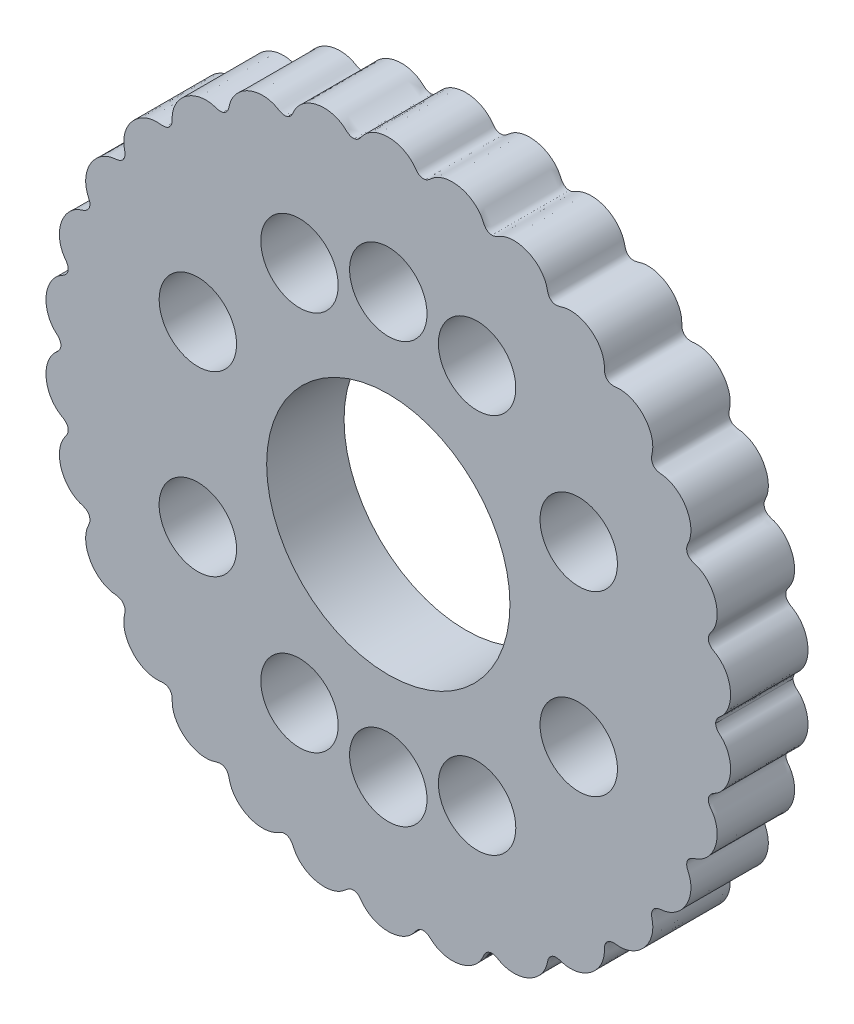
from build123d import *

# Parameters (mm, degrees)
BOSS_EXTRU_1_DEPTH      = 7
ESQUISSE2_R             = 3.5
ESQUISSE2_R_2           = 11
ENL_V_MAT_EXTRU_1_DEPTH = 45.429222529


with BuildPart() as part:
    # Esquisse1 → Boss.-Extru.1 (new body)
    with BuildSketch(Plane.XY):
        with BuildLine():
            add(Edge.make_bspline(
                [(29.6, 0), (29.6, -0.17346587), (29.759106864, -0.535683821), (30.110962154, -0.799020647), (30.373779595, -1.103467186), (30.671023666, -1.560938048), (30.906540811, -2.208142452), (30.979869374, -3.033375854), (30.845247931, -3.851352131), (30.565023341, -4.481835856), (30.246485608, -4.925727722), (29.960253365, -5.217593452), (29.640960083, -5.465239042), (29.250815494, -5.647425417), (28.885266009, -6.097323866), (28.977251739, -6.67834267), (29.271750181, -7.022312781), (29.468763653, -7.36916575), (29.619679918, -7.750390298), (29.740086607, -8.282593055), (29.751778171, -8.972575413), (29.555422294, -9.777910352), (29.16527121, -10.508677165), (28.695257551, -11.013160126), (28.244812231, -11.319043922), (27.880647842, -11.499834787), (27.471579825, -11.595893446), (27.006318633, -11.933415225), (26.943348567, -12.521679856), (27.160884744, -12.93167147), (27.28616792, -13.308128069), (27.382434324, -13.846858227), (27.347084399, -14.533511523), (27.091766805, -15.321922336), (26.647653324, -16.021873377), (26.143416519, -16.492765788), (25.676630094, -16.777708905), (25.300421903, -16.935538553), (24.906058058, -17.040890389), (24.494101091, -17.052935571), (23.964164193, -17.258068951), (23.748162441, -17.811308884), (23.871884113, -18.272098831), (23.921990477, -18.662658592), (23.912556095, -19.073830569), (23.816632957, -19.610230054), (23.55779036, -20.250114552), (23.0619827, -20.914113125), (22.524366522, -21.347803801), (22.039223061, -21.602326195), (21.65347199, -21.742191386), (21.253820824, -21.822573441), (20.844527947, -21.847377521), (20.445954866, -21.779629443), (19.887950327, -21.842445056), (19.533169106, -22.321486778), (19.54913905, -22.809933424), (19.52364967, -23.201313883), (19.402047704, -23.736377502), (19.102706862, -24.354093818), (18.559180614, -24.980010528), (17.876540404, -25.450186019), (17.228367831, -25.686652916), (16.687037507, -25.767074422), (16.279495117, -25.766957178), (15.872536835, -25.709400019), (15.499435367, -25.567806904), (14.951946533, -25.489634994), (14.482469666, -25.858978976), (14.381997189, -26.350233363), (14.28318815, -26.727726776), (14.113532411, -27.103499941), (13.817229931, -27.559932344), (13.328856115, -28.047927141), (12.612717453, -28.46490585), (11.815803643, -28.691258289), (11.125530625, -28.703647155), (10.592785504, -28.596321983), (10.204619525, -28.458251539), (9.869656438, -28.250580278), (9.36658074, -28.041508581), (8.815683348, -28.274758843), (8.597136023, -28.738509951), (8.428826025, -29.090348232), (8.107333171, -29.536038305), (7.592223672, -29.988306479), (6.846929131, -30.351760445), (6.034805208, -30.517180952), (5.345658074, -30.481539312), (4.815617997, -30.344351904), (4.439970071, -30.186483287), (4.086904742, -29.973347138), (3.798973513, -29.707611401), (3.371132482, -29.38740255), (2.777656314, -29.466938238), (2.447129594, -29.873895348), (2.215574619, -30.187513863), (1.912079782, -30.467158531), (1.462361721, -30.772632638), (0.822066691, -31.031016675), (2.605e-06, -31.134490934), (-0.822065298, -31.03101861), (-1.462347798, -30.772627846), (-1.912078643, -30.467167923), (-2.215568462, -30.18754546), (-2.446981162, -29.873962582), (-2.777700278, -29.466906136), (-3.371115881, -29.387410247), (-3.798972625, -29.707607875), (-4.086902915, -29.973347378), (-4.439969921, -30.186483038), (-4.815617939, -30.344351951), (-5.34565821, -30.481539306), (-6.034805188, -30.517180961), (-6.846929138, -30.351760446), (-7.592223668, -29.988306482), (-8.10733317, -29.536038305), (-8.428826025, -29.090348234), (-8.597136023, -28.738509951), (-8.815683348, -28.274758843), (-9.36658074, -28.041508581), (-9.869656438, -28.250580278), (-10.204619526, -28.458251539), (-10.592785504, -28.596321983), (-11.125530625, -28.703647155), (-11.815803643, -28.691258289), (-12.612717453, -28.46490585), (-13.328856115, -28.047927141), (-13.817229931, -27.559932344), (-14.113532411, -27.103499941), (-14.28318815, -26.727726776), (-14.381997189, -26.350233363), (-14.482469666, -25.858978976), (-14.951946533, -25.489634994), (-15.499435367, -25.567806904), (-15.872536835, -25.709400019), (-16.279495117, -25.766957178), (-16.687037507, -25.767074422), (-17.228367831, -25.686652916), (-17.876540404, -25.450186019), (-18.559180614, -24.980010528), (-19.102706862, -24.354093818), (-19.402047704, -23.736377502), (-19.52364967, -23.201313883), (-19.54913905, -22.809933424), (-19.533169106, -22.321486778), (-19.887950327, -21.842445056), (-20.445954866, -21.779629443), (-20.844527947, -21.847377521), (-21.253820824, -21.822573441), (-21.65347199, -21.742191386), (-22.039223061, -21.602326195), (-22.524366522, -21.347803801), (-23.0619827, -20.914113125), (-23.55779036, -20.250114552), (-23.816632957, -19.610230054), (-23.912556095, -19.073830569), (-23.921990477, -18.662658592), (-23.871884113, -18.272098831), (-23.748162441, -17.811308884), (-23.964164193, -17.258068951), (-24.494101091, -17.052935571), (-24.906058058, -17.040890389), (-25.300421903, -16.935538553), (-25.676630094, -16.777708905), (-26.143416519, -16.492765788), (-26.647653324, -16.021873377), (-27.091766805, -15.321922336), (-27.347084399, -14.533511523), (-27.382434324, -13.846858227), (-27.28616792, -13.308128069), (-27.160884744, -12.93167147), (-26.943348567, -12.521679856), (-27.006318633, -11.933415225), (-27.471579825, -11.595893446), (-27.880647842, -11.499834787), (-28.244812231, -11.319043922), (-28.695257551, -11.013160126), (-29.16527121, -10.508677165), (-29.555422294, -9.777910352), (-29.751778171, -8.972575413), (-29.740086607, -8.282593055), (-29.619679918, -7.750390298), (-29.468763653, -7.36916575), (-29.271750181, -7.022312781), (-28.977251739, -6.67834267), (-28.885266009, -6.097323865), (-29.250815494, -5.647425417), (-29.640960087, -5.465239037), (-29.960253369, -5.21759345), (-30.246485627, -4.925727692), (-30.565023311, -4.481835895), (-30.845247881, -3.851352289), (-30.979869416, -3.033375465), (-30.906540141, -2.208144398), (-30.671024291, -1.560932394), (-30.373775505, -1.103469197), (-30.110957739, -0.799017142), (-29.759108597, -0.535685391), (-29.6, -0.173466016), (-29.6, 0)],
                knots=[0.074015259, 0.074015259, 0.074015259, 0.074015259, 0.077343265, 0.080671271, 0.083999277, 0.087327283, 0.093983294, 0.100639306, 0.107295317, 0.113951329, 0.117279335, 0.12060734, 0.123935346, 0.127263352, 0.130591358, 0.133919364, 0.137247369, 0.140575375, 0.143903381, 0.147231387, 0.153887398, 0.16054341, 0.167199421, 0.173855433, 0.177183439, 0.180511445, 0.18383945, 0.187167456, 0.190495462, 0.193823468, 0.197151474, 0.200479479, 0.207135491, 0.213791502, 0.220447514, 0.227103526, 0.230431531, 0.233759537, 0.237087543, 0.240415549, 0.243743555, 0.24707156, 0.250399566, 0.253727572, 0.257055578, 0.260383583, 0.267039595, 0.273695607, 0.280351618, 0.283679624, 0.28700763, 0.290335636, 0.293663641, 0.296991647, 0.300319653, 0.303647659, 0.306975664, 0.31030367, 0.313631676, 0.320287688, 0.326943699, 0.333599711, 0.340255722, 0.343583728, 0.346911734, 0.35023974, 0.353567745, 0.356895751, 0.360223757, 0.363551763, 0.366879769, 0.370207774, 0.37353578, 0.380191792, 0.386847803, 0.393503815, 0.400159826, 0.403487832, 0.406815838, 0.410143844, 0.41347185, 0.416799855, 0.420127861, 0.423455867, 0.426783873, 0.433439884, 0.440095896, 0.446751907, 0.453407919, 0.456735925, 0.460063931, 0.463391936, 0.466719942, 0.470047948, 0.473375954, 0.47670396, 0.480031965, 0.483359971, 0.486687977, 0.493343988, 0.5, 0.506656012, 0.513312023, 0.516640029, 0.519968035, 0.52329604, 0.526624046, 0.529952052, 0.533280058, 0.536608064, 0.539936069, 0.543264075, 0.546592081, 0.553248093, 0.559904104, 0.566560116, 0.573216127, 0.576544133, 0.579872139, 0.583200145, 0.58652815, 0.589856156, 0.593184162, 0.596512168, 0.599840174, 0.606496185, 0.613152197, 0.619808208, 0.62646422, 0.629792226, 0.633120231, 0.636448237, 0.639776243, 0.643104249, 0.646432255, 0.64976026, 0.653088266, 0.656416272, 0.659744278, 0.666400289, 0.673056301, 0.679712312, 0.686368324, 0.68969633, 0.693024336, 0.696352341, 0.699680347, 0.703008353, 0.706336359, 0.709664364, 0.71299237, 0.716320376, 0.719648382, 0.726304393, 0.732960405, 0.739616417, 0.742944422, 0.746272428, 0.749600434, 0.75292844, 0.756256445, 0.759584451, 0.762912457, 0.766240463, 0.769568469, 0.772896474, 0.779552486, 0.786208498, 0.792864509, 0.799520521, 0.802848526, 0.806176532, 0.809504538, 0.812832544, 0.81616055, 0.819488555, 0.822816561, 0.826144567, 0.832800579, 0.83945659, 0.846112602, 0.852768613, 0.856096619, 0.859424625, 0.862752631, 0.866080636, 0.869408642, 0.872736648, 0.876064654, 0.87939266, 0.882720665, 0.886048671, 0.892704683, 0.899360694, 0.906016706, 0.912672717, 0.916000723, 0.919328729, 0.922656735, 0.925984741, 0.925984741, 0.925984741, 0.925984741], degree=3))
            add(Edge.make_bspline(
                [(-29.6, 0), (-29.6, 0.173466016), (-29.759108597, 0.535685391), (-30.110957739, 0.799017142), (-30.373775505, 1.103469197), (-30.671024291, 1.560932394), (-30.906540141, 2.208144398), (-30.979869416, 3.033375465), (-30.845247881, 3.851352289), (-30.565023311, 4.481835895), (-30.246485627, 4.925727692), (-29.960253369, 5.21759345), (-29.640960087, 5.465239037), (-29.250815494, 5.647425417), (-28.885266009, 6.097323865), (-28.977251739, 6.67834267), (-29.271750181, 7.022312781), (-29.468763653, 7.36916575), (-29.619679918, 7.750390298), (-29.740086607, 8.282593055), (-29.751778171, 8.972575413), (-29.555422294, 9.777910352), (-29.16527121, 10.508677165), (-28.695257551, 11.013160126), (-28.244812231, 11.319043922), (-27.880647842, 11.499834787), (-27.471579825, 11.595893446), (-27.006318633, 11.933415225), (-26.943348567, 12.521679856), (-27.160884744, 12.93167147), (-27.28616792, 13.308128069), (-27.382434324, 13.846858227), (-27.347084399, 14.533511523), (-27.091766805, 15.321922336), (-26.647653324, 16.021873377), (-26.143416519, 16.492765788), (-25.676630094, 16.777708905), (-25.300421903, 16.935538553), (-24.906058058, 17.040890389), (-24.494101091, 17.052935571), (-23.964164193, 17.258068951), (-23.748162441, 17.811308884), (-23.871884113, 18.272098831), (-23.921990477, 18.662658592), (-23.912556095, 19.073830569), (-23.816632957, 19.610230054), (-23.55779036, 20.250114552), (-23.0619827, 20.914113125), (-22.524366522, 21.347803801), (-22.039223061, 21.602326195), (-21.65347199, 21.742191386), (-21.253820824, 21.822573441), (-20.844527947, 21.847377521), (-20.445954866, 21.779629443), (-19.887950327, 21.842445056), (-19.533169106, 22.321486778), (-19.54913905, 22.809933424), (-19.52364967, 23.201313883), (-19.402047704, 23.736377502), (-19.102706862, 24.354093818), (-18.559180614, 24.980010528), (-17.876540404, 25.450186019), (-17.228367831, 25.686652916), (-16.687037507, 25.767074422), (-16.279495117, 25.766957178), (-15.872536835, 25.709400019), (-15.499435367, 25.567806904), (-14.951946533, 25.489634994), (-14.482469666, 25.858978976), (-14.381997189, 26.350233363), (-14.28318815, 26.727726776), (-14.113532411, 27.103499941), (-13.817229931, 27.559932344), (-13.328856115, 28.047927141), (-12.612717453, 28.46490585), (-11.815803643, 28.691258289), (-11.125530625, 28.703647155), (-10.592785504, 28.596321983), (-10.204619526, 28.458251539), (-9.869656438, 28.250580278), (-9.36658074, 28.041508581), (-8.815683348, 28.274758843), (-8.597136023, 28.738509951), (-8.428826025, 29.090348234), (-8.10733317, 29.536038305), (-7.592223668, 29.988306482), (-6.846929138, 30.351760446), (-6.034805188, 30.517180961), (-5.34565821, 30.481539306), (-4.815617939, 30.344351951), (-4.439969921, 30.186483038), (-4.086902915, 29.973347378), (-3.798972625, 29.707607875), (-3.371115881, 29.387410247), (-2.777700278, 29.466906136), (-2.446981162, 29.873962582), (-2.215568462, 30.18754546), (-1.912078643, 30.467167923), (-1.462347798, 30.772627846), (-0.822065298, 31.03101861), (2.605e-06, 31.134490934), (0.822066691, 31.031016675), (1.462361721, 30.772632638), (1.912079782, 30.467158531), (2.215574619, 30.187513863), (2.447129594, 29.873895348), (2.777656314, 29.466938238), (3.371132482, 29.38740255), (3.798973513, 29.707611401), (4.086904742, 29.973347138), (4.439970071, 30.186483287), (4.815617997, 30.344351904), (5.345658074, 30.481539312), (6.034805208, 30.517180952), (6.846929131, 30.351760445), (7.592223672, 29.988306479), (8.107333171, 29.536038305), (8.428826025, 29.090348232), (8.597136023, 28.738509951), (8.815683348, 28.274758843), (9.36658074, 28.041508581), (9.869656438, 28.250580278), (10.204619526, 28.458251539), (10.592785504, 28.596321983), (11.125530625, 28.703647155), (11.815803643, 28.691258289), (12.612717453, 28.46490585), (13.328856115, 28.047927141), (13.817229931, 27.559932344), (14.113532411, 27.103499941), (14.28318815, 26.727726776), (14.381997189, 26.350233363), (14.482469666, 25.858978976), (14.951946533, 25.489634994), (15.499435367, 25.567806904), (15.872536835, 25.709400019), (16.279495117, 25.766957178), (16.687037507, 25.767074422), (17.228367831, 25.686652916), (17.876540404, 25.450186019), (18.559180614, 24.980010528), (19.102706862, 24.354093818), (19.402047704, 23.736377502), (19.52364967, 23.201313883), (19.54913905, 22.809933424), (19.533169106, 22.321486778), (19.887950327, 21.842445056), (20.445954866, 21.779629443), (20.844527947, 21.847377521), (21.253820824, 21.822573441), (21.65347199, 21.742191386), (22.039223061, 21.602326195), (22.524366522, 21.347803801), (23.0619827, 20.914113125), (23.55779036, 20.250114552), (23.816632957, 19.610230054), (23.912556095, 19.073830569), (23.921990477, 18.662658592), (23.871884113, 18.272098831), (23.748162441, 17.811308884), (23.964164193, 17.258068951), (24.494101091, 17.052935571), (24.906058058, 17.040890389), (25.300421903, 16.935538553), (25.676630094, 16.777708905), (26.143416519, 16.492765788), (26.647653324, 16.021873377), (27.091766805, 15.321922336), (27.347084399, 14.533511523), (27.382434324, 13.846858227), (27.28616792, 13.308128069), (27.160884744, 12.93167147), (26.943348567, 12.521679856), (27.006318633, 11.933415225), (27.471579825, 11.595893446), (27.880647842, 11.499834787), (28.244812231, 11.319043922), (28.695257551, 11.013160126), (29.16527121, 10.508677165), (29.555422294, 9.777910352), (29.751778171, 8.972575413), (29.740086607, 8.282593055), (29.619679918, 7.750390298), (29.468763653, 7.36916575), (29.271750181, 7.022312781), (28.977251739, 6.67834267), (28.885266009, 6.097323866), (29.250815494, 5.647425417), (29.640960083, 5.465239042), (29.960253365, 5.217593452), (30.246485608, 4.925727722), (30.565023341, 4.481835856), (30.845247931, 3.851352131), (30.979869374, 3.033375854), (30.906540811, 2.208142452), (30.671023666, 1.560938048), (30.373779595, 1.103467186), (30.110962154, 0.799020647), (29.759106864, 0.535683821), (29.6, 0.17346587), (29.6, 0)],
                knots=[0.074015259, 0.074015259, 0.074015259, 0.074015259, 0.077343265, 0.080671271, 0.083999277, 0.087327283, 0.093983294, 0.100639306, 0.107295317, 0.113951329, 0.117279335, 0.12060734, 0.123935346, 0.127263352, 0.130591358, 0.133919364, 0.137247369, 0.140575375, 0.143903381, 0.147231387, 0.153887398, 0.16054341, 0.167199421, 0.173855433, 0.177183439, 0.180511445, 0.18383945, 0.187167456, 0.190495462, 0.193823468, 0.197151474, 0.200479479, 0.207135491, 0.213791502, 0.220447514, 0.227103526, 0.230431531, 0.233759537, 0.237087543, 0.240415549, 0.243743555, 0.24707156, 0.250399566, 0.253727572, 0.257055578, 0.260383583, 0.267039595, 0.273695607, 0.280351618, 0.283679624, 0.28700763, 0.290335636, 0.293663641, 0.296991647, 0.300319653, 0.303647659, 0.306975664, 0.31030367, 0.313631676, 0.320287688, 0.326943699, 0.333599711, 0.340255722, 0.343583728, 0.346911734, 0.35023974, 0.353567745, 0.356895751, 0.360223757, 0.363551763, 0.366879769, 0.370207774, 0.37353578, 0.380191792, 0.386847803, 0.393503815, 0.400159826, 0.403487832, 0.406815838, 0.410143844, 0.41347185, 0.416799855, 0.420127861, 0.423455867, 0.426783873, 0.433439884, 0.440095896, 0.446751907, 0.453407919, 0.456735925, 0.460063931, 0.463391936, 0.466719942, 0.470047948, 0.473375954, 0.47670396, 0.480031965, 0.483359971, 0.486687977, 0.493343988, 0.5, 0.506656012, 0.513312023, 0.516640029, 0.519968035, 0.52329604, 0.526624046, 0.529952052, 0.533280058, 0.536608064, 0.539936069, 0.543264075, 0.546592081, 0.553248093, 0.559904104, 0.566560116, 0.573216127, 0.576544133, 0.579872139, 0.583200145, 0.58652815, 0.589856156, 0.593184162, 0.596512168, 0.599840174, 0.606496185, 0.613152197, 0.619808208, 0.62646422, 0.629792226, 0.633120231, 0.636448237, 0.639776243, 0.643104249, 0.646432255, 0.64976026, 0.653088266, 0.656416272, 0.659744278, 0.666400289, 0.673056301, 0.679712312, 0.686368324, 0.68969633, 0.693024336, 0.696352341, 0.699680347, 0.703008353, 0.706336359, 0.709664364, 0.71299237, 0.716320376, 0.719648382, 0.726304393, 0.732960405, 0.739616417, 0.742944422, 0.746272428, 0.749600434, 0.75292844, 0.756256445, 0.759584451, 0.762912457, 0.766240463, 0.769568469, 0.772896474, 0.779552486, 0.786208498, 0.792864509, 0.799520521, 0.802848526, 0.806176532, 0.809504538, 0.812832544, 0.81616055, 0.819488555, 0.822816561, 0.826144567, 0.832800579, 0.83945659, 0.846112602, 0.852768613, 0.856096619, 0.859424625, 0.862752631, 0.866080636, 0.869408642, 0.872736648, 0.876064654, 0.87939266, 0.882720665, 0.886048671, 0.892704683, 0.899360694, 0.906016706, 0.912672717, 0.916000723, 0.919328729, 0.922656735, 0.925984741, 0.925984741, 0.925984741, 0.925984741], degree=3))
        make_face()
    extrude(amount=BOSS_EXTRU_1_DEPTH)

    # Esquisse2 → Enlèv. mat.-Extru.1 (cut, through all)
    with BuildSketch(Plane.XY.offset(7)):
        with Locations((-8.029746973, 17.219847954)):
            Circle(ESQUISSE2_R)
        with Locations(Location((8.029746973, 17.219847954, 0), (0, 0, 180))):
            Circle(ESQUISSE2_R)
        with Locations((17.219847954, 8.029746973)):
            Circle(ESQUISSE2_R)
        with Locations(Location((17.219847954, -8.029746973, 0), (0, 0, 180))):
            Circle(ESQUISSE2_R)
        with Locations((8.029746973, -17.219847954)):
            Circle(ESQUISSE2_R)
        with Locations(Location((-8.029746973, -17.219847954, 0), (0, 0, 180))):
            Circle(ESQUISSE2_R)
        with Locations((-17.219847954, -8.029746973)):
            Circle(ESQUISSE2_R)
        with Locations(Location((-17.219847954, 8.029746973, 0), (0, 0, 180))):
            Circle(ESQUISSE2_R)
        Circle(ESQUISSE2_R_2)
        with Locations((0, 19)):
            Circle(ESQUISSE2_R)
        with Locations((0, -19)):
            Circle(ESQUISSE2_R)
    extrude(amount=-ENL_V_MAT_EXTRU_1_DEPTH, mode=Mode.SUBTRACT)


solid = part.part
